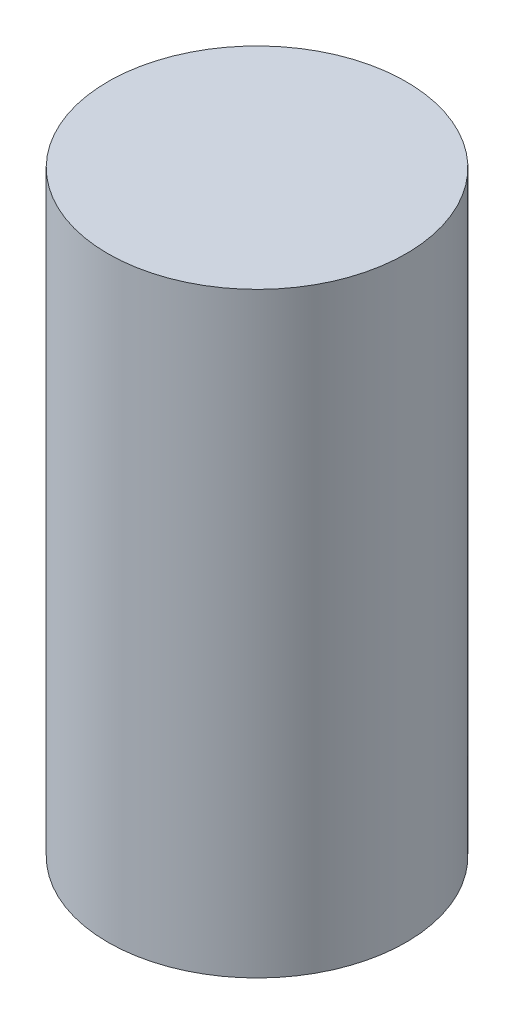
from build123d import *

# Parameters (mm, degrees)
SKETCH1_R           = 1
BOSS_EXTRUDE1_DEPTH = 4


with BuildPart() as part:
    # Sketch1 → Boss-Extrude1 (new body)
    with BuildSketch(Plane(origin=(0, 0, 0), x_dir=(1, 0, 0), z_dir=(0, 1, 0))):
        with Locations(Location((0, 0, 0), (0, 0, 270))):
            Circle(SKETCH1_R)
    extrude(amount=BOSS_EXTRUDE1_DEPTH)


solid = part.part
